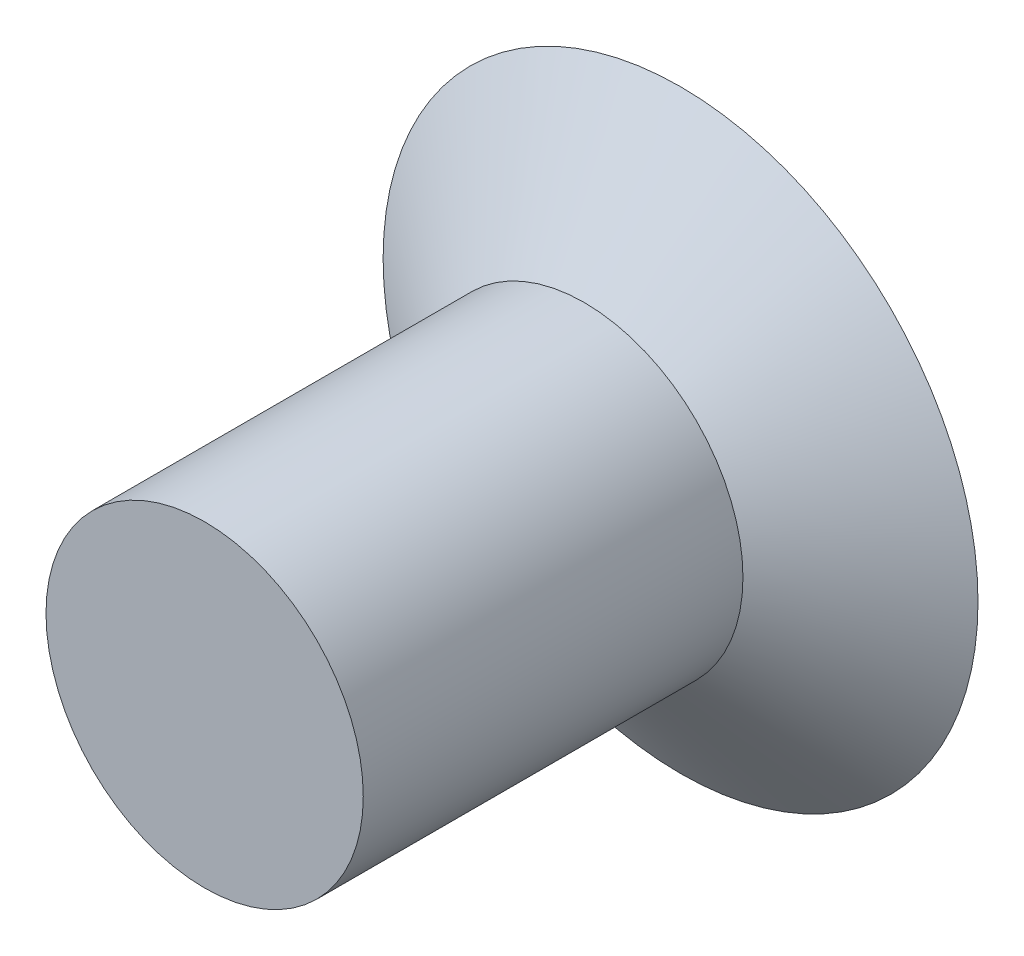
from build123d import *

# Parameters (mm, degrees)
SKETCH_1_R      = 2
EXTRUDE_1_DEPTH = 6


with BuildPart() as part:
    # 草图1 → 凸台-拉伸1 (new body)
    with BuildSketch(Plane.XY):
        Circle(SKETCH_1_R)
    extrude(amount=EXTRUDE_1_DEPTH)

    # 草图2 → 旋转1 (revolve)
    with BuildSketch(Plane(origin=(0, 0, 0), x_dir=(1, 0, 0), z_dir=(0, 1, 0)), mode=Mode.PRIVATE) as revolve_1_sk:
        Polygon((0, 0), (3.75, 0), (0, -2.6), align=None)
    revolve(revolve_1_sk.sketch.rotate(Axis((0, 0, 2.6), (0, 0, -1)), 180), axis=Axis((0, 0, 2.6), (0, 0, -1)))


solid = part.part
